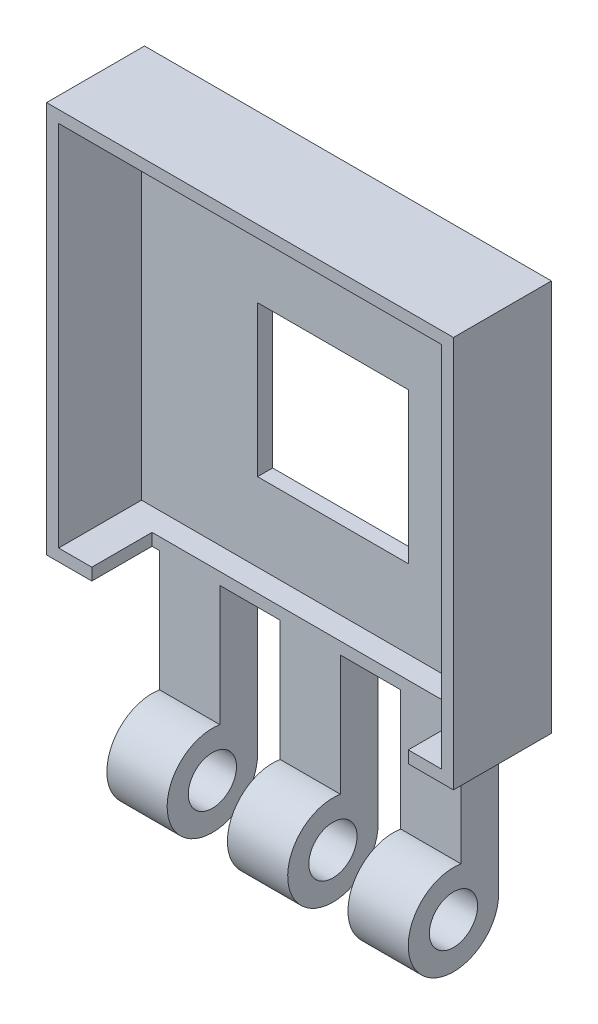
from build123d import *

# Parameters (mm, degrees)
ESQUISSE1_W                    = 27
ESQUISSE1_H                    = 26
ESQUISSE1_W_2                  = 10
ESQUISSE1_H_2                  = 10
BOSS_EXTRU_1_DEPTH             = 1
ESQUISSE2_W                    = 27
ESQUISSE2_H                    = 26
ESQUISSE2_W_2                  = 25.4
ESQUISSE2_H_2                  = 24.4
BOSS_EXTRU_2_DEPTH             = 5.5
ENL_V_MAT_EXTRU_1_REACH        = 32.008
ESQUISSE3_W                    = 21
ESQUISSE3_H                    = 4
ESQUISSE4_R                    = 1.6
BOSS_EXTRU_3_DEPTH             = 2
R_P_TITION_LIN_AIRE1_COUNT     = 2
R_P_TITION_LIN_AIRE1_PITCH     = 8
R_P_TITION_LIN_AIRE1_COL_COUNT = 2
R_P_TITION_LIN_AIRE1_COL_PITCH = 8


with BuildPart() as part:
    # Esquisse1 → Boss.-Extru.1 (new body)
    with BuildSketch(Plane.XY):
        with Locations((0, 13)):
            Rectangle(ESQUISSE1_W, ESQUISSE1_H)
        with Locations((0, 11)):
            Rectangle(ESQUISSE1_W_2, ESQUISSE1_H_2, mode=Mode.SUBTRACT)
    extrude(amount=BOSS_EXTRU_1_DEPTH)

    # Esquisse2 → Boss.-Extru.2 (add)
    with BuildSketch(Plane.XY.offset(1)):
        with Locations((0, 13)):
            Rectangle(ESQUISSE2_W, ESQUISSE2_H)
        with Locations((0, 13)):
            Rectangle(ESQUISSE2_W_2, ESQUISSE2_H_2, mode=Mode.SUBTRACT)
    extrude(amount=BOSS_EXTRU_2_DEPTH)

    # Esquisse3 → Enlèv. mat.-Extru.1 (cut, up to next)
    with BuildSketch(Plane.XZ, mode=Mode.PRIVATE) as enl_v_mat_extru_1_sk1:
        with Locations((0, 4.5)):
            Rectangle(ESQUISSE3_W, ESQUISSE3_H)
    enl_v_mat_extru_1_tool1 = extrude(enl_v_mat_extru_1_sk1.sketch, amount=-ENL_V_MAT_EXTRU_1_REACH, mode=Mode.PRIVATE) & part.part
    add(enl_v_mat_extru_1_tool1.solids().sort_by_distance((0, 0, 4.5))[0], mode=Mode.SUBTRACT)

    # Esquisse4 → Boss.-Extru.3 (add, symmetric)
    with BuildSketch(Plane(origin=(0, 0, 0), x_dir=(0, 0, -1), z_dir=(1, 0, 0))):
        with BuildLine():
            Line((0, -8), (0, -10.958039892))
            ThreePointArc((0, -10.958039892), (-5.291287847, -12.894531565), (-2.5, -8))
            Line((-2.5, -8), (-2.5, 0))
            Line((-2.5, 0), (0, 0))
            Line((0, 0), (0, -8))
        make_face()
        with Locations((-3, -10.958039892)):
            Circle(ESQUISSE4_R, mode=Mode.SUBTRACT)
    boss_extru_3 = extrude(amount=BOSS_EXTRU_3_DEPTH, both=True)

    # Répétition linéaire1: Boss.-Extru.3 ×2
    with Locations(*[(-i * R_P_TITION_LIN_AIRE1_PITCH, 0, 0) for i in range(1, R_P_TITION_LIN_AIRE1_COUNT)]):
        add(boss_extru_3)

    # Répétition linéaire1 col: Boss.-Extru.3 ×2
    with Locations(*[(i * R_P_TITION_LIN_AIRE1_COL_PITCH, 0, 0) for i in range(1, R_P_TITION_LIN_AIRE1_COL_COUNT)]):
        add(boss_extru_3)


solid = part.part
